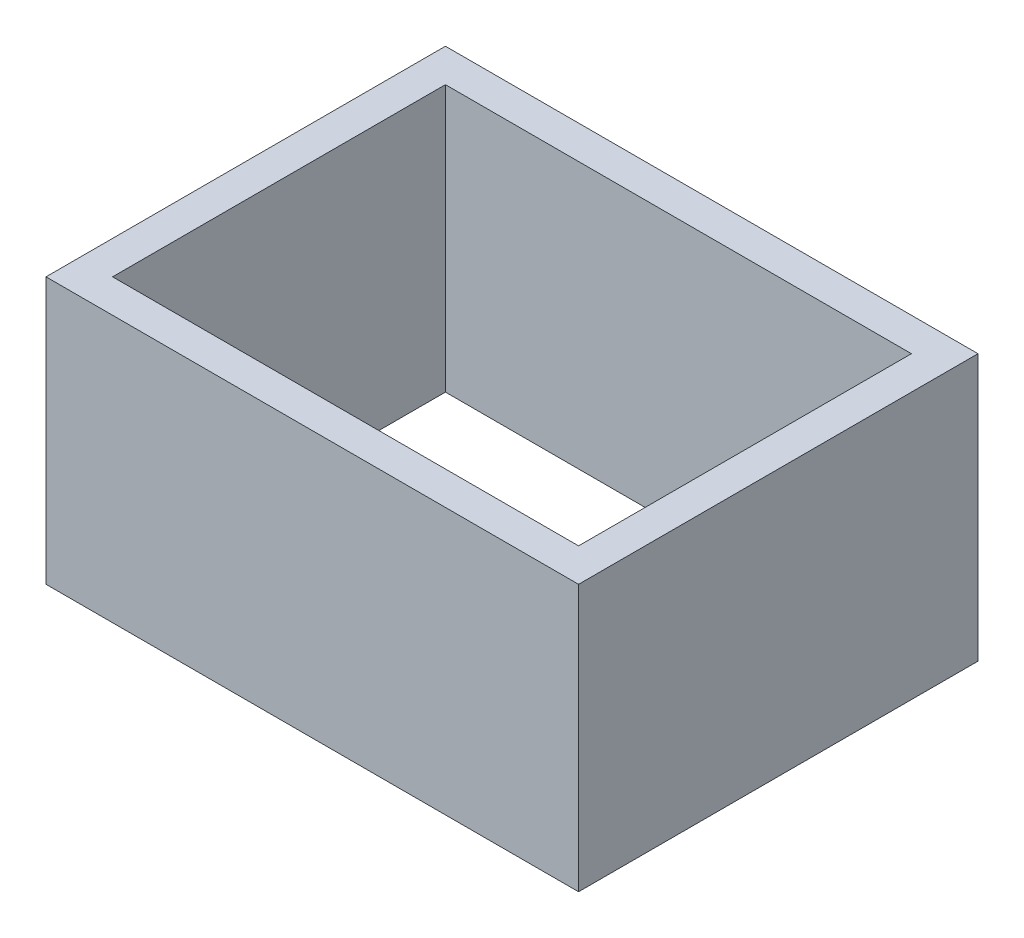
from build123d import *

# Parameters (mm, degrees)
SKETCH1_W           = 50.8
SKETCH1_H           = 38.1
BOSS_EXTRUDE1_DEPTH = 25.4
SHELL1_T            = -3.175


with BuildPart() as part:
    # Sketch1 → Boss-Extrude1 (new body)
    with BuildSketch(Plane(origin=(0, 0, 0), x_dir=(1, 0, 0), z_dir=(0, 1, 0))):
        Rectangle(SKETCH1_W, SKETCH1_H)
    extrude(amount=BOSS_EXTRUDE1_DEPTH)

    # Shell1
    shell1_openings = [part.faces().sort_by_distance(p)[0] for p in [
        (0, 25.4, 0),
        (0, 0, 0),
    ]]
    offset(amount=SHELL1_T, openings=shell1_openings, kind=Kind.INTERSECTION)


solid = part.part
